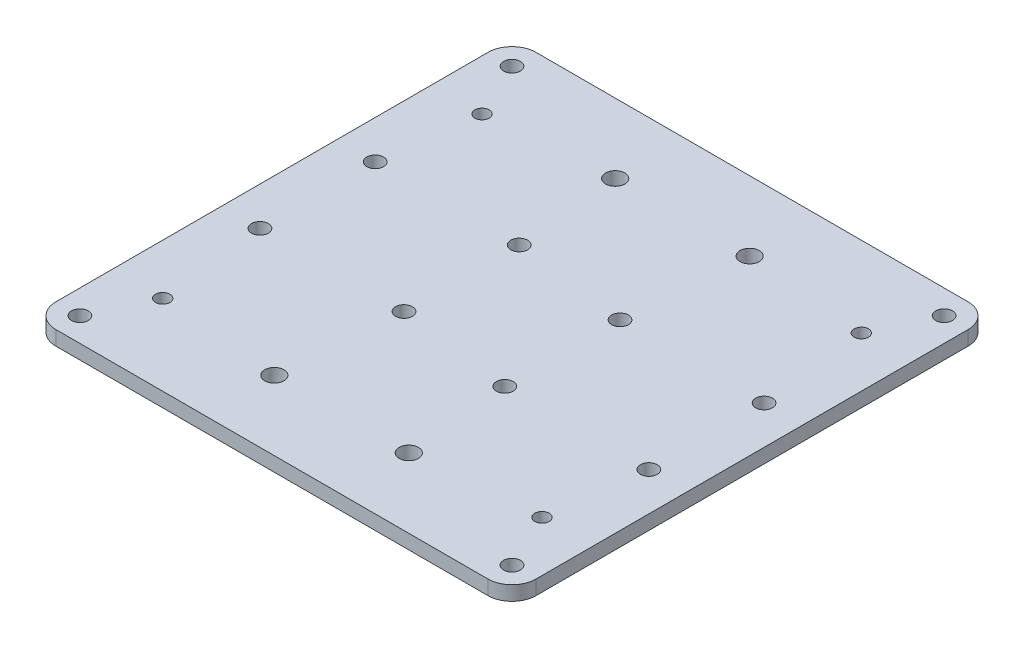
from build123d import *

# Parameters (mm, degrees)
SKETCH_1_R      = 1.75
SKETCH_1_R_2    = 2
SKETCH_1_R_3    = 1.5
EXTRUDE_1_DEPTH = 3


with BuildPart() as part:
    # 草图1 → 凸台-拉伸1 (new body)
    with BuildSketch(Plane(origin=(0, 0, 0), x_dir=(1, 0, 0), z_dir=(0, 1, 0))):
        with BuildLine():
            Line((-45, 50), (45, 50))
            ThreePointArc((45, 50), (48.535533906, 48.535533906), (50, 45))
            Line((50, 45), (50, -45))
            ThreePointArc((50, -45), (48.535533906, -48.535533906), (45, -50))
            Line((45, -50), (-45, -50))
            ThreePointArc((-45, -50), (-48.535533906, -48.535533906), (-50, -45))
            Line((-50, -45), (-50, 45))
            ThreePointArc((-50, 45), (-48.535533906, 48.535533906), (-45, 50))
        make_face()
        with Locations(Location((-45, 45, 0), (0, 0, 270))):
            Circle(SKETCH_1_R, mode=Mode.SUBTRACT)
        with Locations(Location((45, 45, 0), (0, 0, 270))):
            Circle(SKETCH_1_R, mode=Mode.SUBTRACT)
        with Locations(Location((-45, -45, 0), (0, 0, 270))):
            Circle(SKETCH_1_R, mode=Mode.SUBTRACT)
        with Locations(Location((45, -45, 0), (0, 0, 270))):
            Circle(SKETCH_1_R, mode=Mode.SUBTRACT)
        with Locations(Location((12, 10.5, 0), (0, 0, 270))):
            Circle(SKETCH_1_R, mode=Mode.SUBTRACT)
        with Locations(Location((42, 10.5, 0), (0, 0, 270))):
            Circle(SKETCH_1_R, mode=Mode.SUBTRACT)
        with Locations(Location((12, -13.5, 0), (0, 0, 270))):
            Circle(SKETCH_1_R, mode=Mode.SUBTRACT)
        with Locations(Location((42, -13.5, 0), (0, 0, 270))):
            Circle(SKETCH_1_R, mode=Mode.SUBTRACT)
        with Locations(Location((-42, 13.5, 0), (0, 0, 270))):
            Circle(SKETCH_1_R, mode=Mode.SUBTRACT)
        with Locations(Location((-12, 13.5, 0), (0, 0, 270))):
            Circle(SKETCH_1_R, mode=Mode.SUBTRACT)
        with Locations(Location((-42, -10.5, 0), (0, 0, 270))):
            Circle(SKETCH_1_R, mode=Mode.SUBTRACT)
        with Locations(Location((-12, -10.5, 0), (0, 0, 270))):
            Circle(SKETCH_1_R, mode=Mode.SUBTRACT)
        with Locations(Location((-14, -35.5, 0), (0, 0, 270))):
            Circle(SKETCH_1_R_2, mode=Mode.SUBTRACT)
        with Locations(Location((14, -35.5, 0), (0, 0, 270))):
            Circle(SKETCH_1_R_2, mode=Mode.SUBTRACT)
        with Locations(Location((-14, 35.5, 0), (0, 0, 270))):
            Circle(SKETCH_1_R_2, mode=Mode.SUBTRACT)
        with Locations(Location((14, 35.5, 0), (0, 0, 270))):
            Circle(SKETCH_1_R_2, mode=Mode.SUBTRACT)
        with Locations(Location((-39.5, 33.25, 0), (0, 0, 270))):
            Circle(SKETCH_1_R_3, mode=Mode.SUBTRACT)
        with Locations(Location((39.5, 33.25, 0), (0, 0, 270))):
            Circle(SKETCH_1_R_3, mode=Mode.SUBTRACT)
        with Locations(Location((-39.5, -33.25, 0), (0, 0, 270))):
            Circle(SKETCH_1_R_3, mode=Mode.SUBTRACT)
        with Locations(Location((39.5, -33.25, 0), (0, 0, 270))):
            Circle(SKETCH_1_R_3, mode=Mode.SUBTRACT)
    extrude(amount=EXTRUDE_1_DEPTH)


solid = part.part
